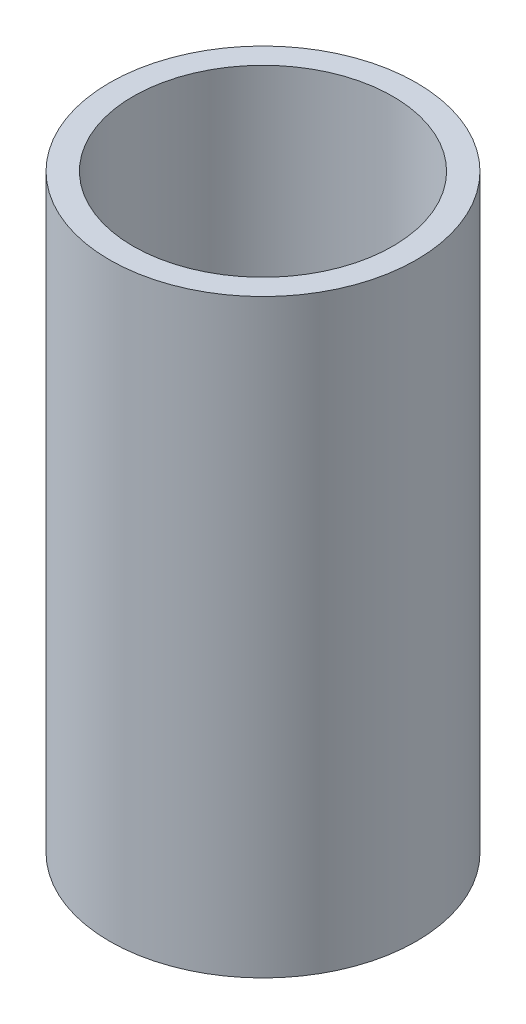
from build123d import *

# Parameters (mm, degrees)
SKETCH1_R           = 2.6
SKETCH1_R_2         = 2.2
BOSS_EXTRUDE1_DEPTH = 10


with BuildPart() as part:
    # Sketch1 → Boss-Extrude1 (new body)
    with BuildSketch(Plane(origin=(0, 0, 0), x_dir=(1, 0, 0), z_dir=(0, 1, 0))):
        with Locations(Location((0, 0, 0), (0, 0, 270))):
            Circle(SKETCH1_R)
        with Locations(Location((0, 0, 0), (0, 0, 270))):
            Circle(SKETCH1_R_2, mode=Mode.SUBTRACT)
    extrude(amount=BOSS_EXTRUDE1_DEPTH)


solid = part.part
